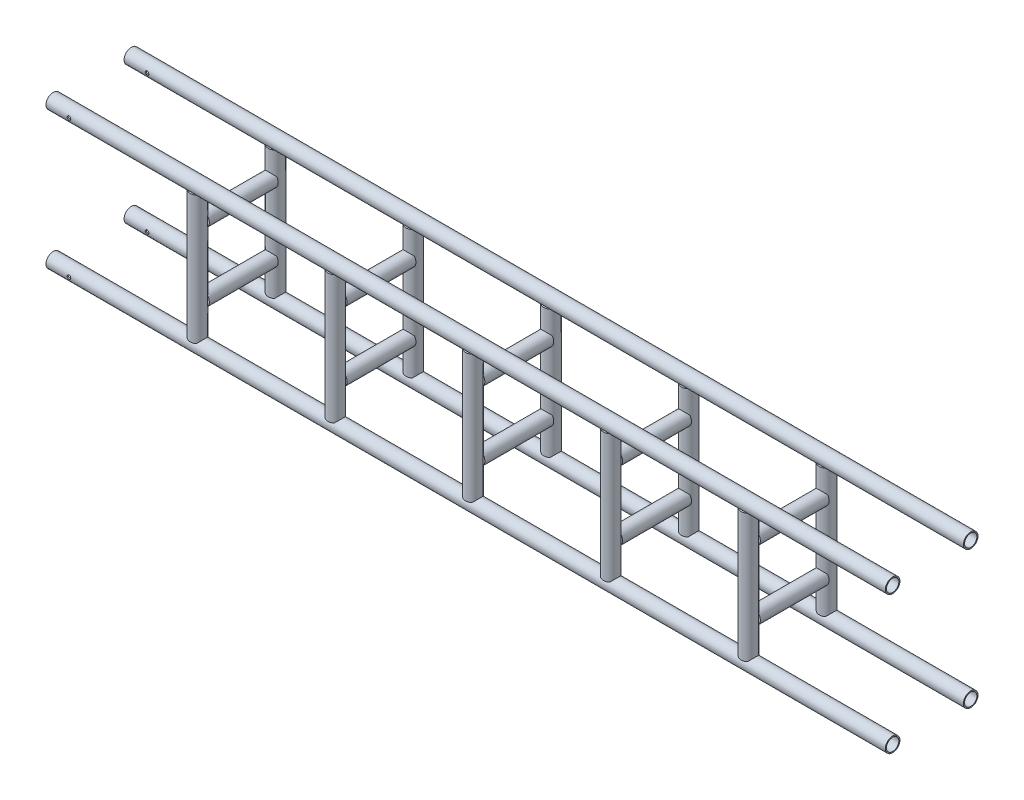
from build123d import *

# Parameters (mm, degrees)
BOSS_EXTRUDE1_DEPTH        = 914
BOSS_EXTRUDE1_DEPTH_BACK   = 914
SKETCH2_R                  = 15.875
SKETCH2_R_2                = 13.462
BOSS_EXTRUDE1_2_DEPTH      = 914
BOSS_EXTRUDE1_2_DEPTH_BACK = 914
BOSS_EXTRUDE1_3_DEPTH      = 914
BOSS_EXTRUDE1_3_DEPTH_BACK = 914
BOSS_EXTRUDE1_4_DEPTH      = 914
BOSS_EXTRUDE1_4_DEPTH_BACK = 914
BOSS_EXTRUDE2_START        = 10
SKETCH3_R                  = 15.875
BOSS_EXTRUDE2_DEPTH        = 280
BOSS_EXTRUDE3_DEPTH        = 75
BOSS_EXTRUDE3_DEPTH_BACK   = 75
SKETCH4_R                  = 15.875
CUT_EXTRUDE1_DEPTH         = 200
CUT_EXTRUDE1_DEPTH_BACK    = 200
SKETCH5_R                  = 4


with BuildPart() as part:
    # Sketch2 → Boss-Extrude1 (new, two sides: drawn at the far end of the back side and taken through both)
    with BuildSketch(Plane(origin=(0, 0, 0), x_dir=(0, 0, -1), z_dir=(1, 0, 0)).offset(-BOSS_EXTRUDE1_DEPTH_BACK)):
        with Locations((-85, 0)):
            Circle(SKETCH2_R)
        with Locations((-85, 0)):
            Circle(SKETCH2_R_2, mode=Mode.SUBTRACT)
    extrude(amount=BOSS_EXTRUDE1_DEPTH + BOSS_EXTRUDE1_DEPTH_BACK)



with BuildPart() as body_2:
    # Sketch2 → Boss-Extrude1 2 (new, two sides: drawn at the far end of the back side and taken through both)
    with BuildSketch(Plane(origin=(0, 0, 0), x_dir=(0, 0, -1), z_dir=(1, 0, 0)).offset(-BOSS_EXTRUDE1_2_DEPTH_BACK)):
        with Locations((85, 0)):
            Circle(SKETCH2_R)
        with Locations((85, 0)):
            Circle(SKETCH2_R_2, mode=Mode.SUBTRACT)
    extrude(amount=BOSS_EXTRUDE1_2_DEPTH + BOSS_EXTRUDE1_2_DEPTH_BACK)


with BuildPart() as body_3:
    # Sketch2 → Boss-Extrude1 3 (new, two sides: drawn at the far end of the back side and taken through both)
    with BuildSketch(Plane(origin=(0, 0, 0), x_dir=(0, 0, -1), z_dir=(1, 0, 0)).offset(-BOSS_EXTRUDE1_3_DEPTH_BACK)):
        with Locations((-85, 300)):
            Circle(SKETCH2_R)
        with Locations((-85, 300)):
            Circle(SKETCH2_R_2, mode=Mode.SUBTRACT)
    extrude(amount=BOSS_EXTRUDE1_3_DEPTH + BOSS_EXTRUDE1_3_DEPTH_BACK)


with BuildPart() as body_4:
    # Sketch2 → Boss-Extrude1 4 (new, two sides: drawn at the far end of the back side and taken through both)
    with BuildSketch(Plane(origin=(0, 0, 0), x_dir=(0, 0, -1), z_dir=(1, 0, 0)).offset(-BOSS_EXTRUDE1_4_DEPTH_BACK)):
        with Locations((85, 300)):
            Circle(SKETCH2_R)
        with Locations((85, 300)):
            Circle(SKETCH2_R_2, mode=Mode.SUBTRACT)
    extrude(amount=BOSS_EXTRUDE1_4_DEPTH + BOSS_EXTRUDE1_4_DEPTH_BACK)


with BuildPart() as part_1:
    add(part.part)

    add(body_2.part)  # Boss-Extrude2 merges body 2

    add(body_3.part)  # Boss-Extrude2 merges body 3

    add(body_4.part)  # Boss-Extrude2 merges body 4
    # Sketch3 → Boss-Extrude2 (add)
    with BuildSketch(Plane(origin=(0, 0, 0), x_dir=(1, 0, 0), z_dir=(0, 1, 0)).offset(BOSS_EXTRUDE2_START)):
        with Locations((0, 85)):
            Circle(SKETCH3_R)
        with Locations((0, -85)):
            Circle(SKETCH3_R)
        with Locations((300, -85)):
            Circle(SKETCH3_R)
        with Locations((300, 85)):
            Circle(SKETCH3_R)
        with Locations((600, -85)):
            Circle(SKETCH3_R)
        with Locations((600, 85)):
            Circle(SKETCH3_R)
        with Locations((-300, -85)):
            Circle(SKETCH3_R)
        with Locations((-300, 85)):
            Circle(SKETCH3_R)
        with Locations((-600, -85)):
            Circle(SKETCH3_R)
        with Locations((-600, 85)):
            Circle(SKETCH3_R)
    extrude(amount=BOSS_EXTRUDE2_DEPTH)

    # Sketch4 → Boss-Extrude3 (add, two sides: drawn at the far end of the back side and taken through both)
    with BuildSketch(Plane.XY.offset(-BOSS_EXTRUDE3_DEPTH_BACK)):
        with Locations((-600, 230)):
            Circle(SKETCH4_R)
        with Locations((-600, 80)):
            Circle(SKETCH4_R)
        with Locations((0, 230)):
            Circle(SKETCH4_R)
        with Locations((0, 80)):
            Circle(SKETCH4_R)
        with Locations((600, 80)):
            Circle(SKETCH4_R)
        with Locations((600, 230)):
            Circle(SKETCH4_R)
        with Locations((-300, 230)):
            Circle(SKETCH4_R)
        with Locations((-300, 80)):
            Circle(SKETCH4_R)
        with Locations((300, 80)):
            Circle(SKETCH4_R)
        with Locations((300, 230)):
            Circle(SKETCH4_R)
    extrude(amount=BOSS_EXTRUDE3_DEPTH + BOSS_EXTRUDE3_DEPTH_BACK)

    # Sketch5 → Cut-Extrude1 (cut, two sides: drawn at the far end of the back side and taken through both)
    with BuildSketch(Plane.XY.offset(-CUT_EXTRUDE1_DEPTH_BACK)):
        with Locations((-864, 0)):
            Circle(SKETCH5_R)
        with Locations((-864, 300)):
            Circle(SKETCH5_R)
    extrude(amount=CUT_EXTRUDE1_DEPTH + CUT_EXTRUDE1_DEPTH_BACK, mode=Mode.SUBTRACT)


solid = part_1.part
